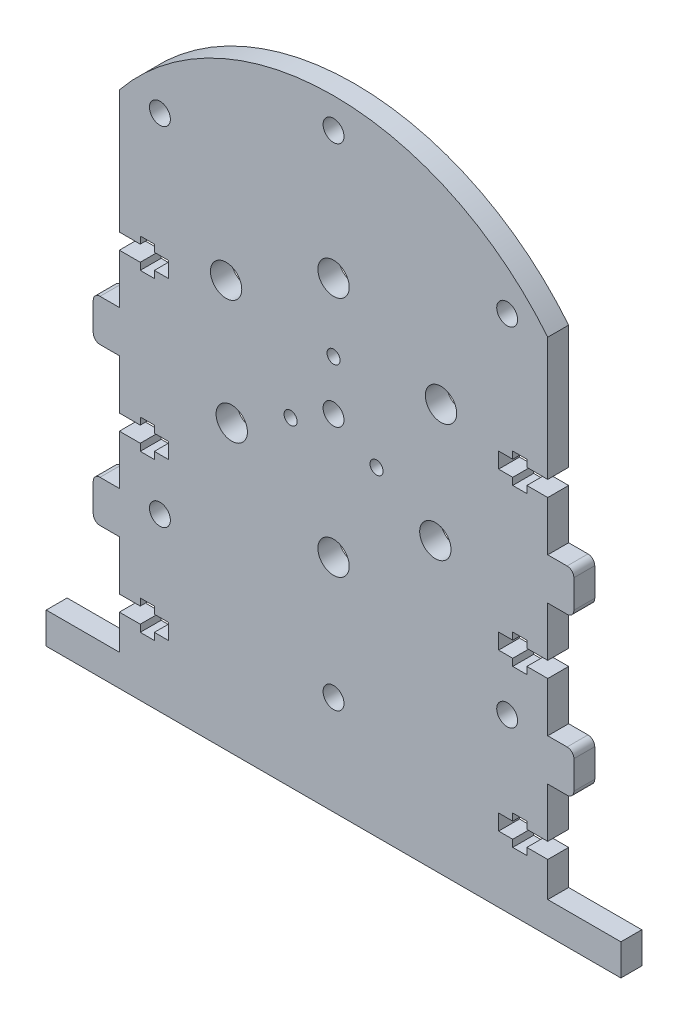
from build123d import *

# Parameters (mm, degrees)
SKETCH_1_R      = 3
SKETCH_1_R_2    = 2
SKETCH_1_R_3    = 1.25
EXTRUDE_2_DEPTH = 4
SKETCH_4_W      = 110
SKETCH_4_H      = 6
EXTRUDE_3_DEPTH = 4
FILLET_1_R      = 1.3


with BuildPart() as part:
    # 草图1 → 凸台-拉伸2 (new body)
    with BuildSketch(Plane.XY):
        with BuildLine():
            Line((26.037512023, -61.503506411), (-55.962487977, -61.503506411))
            Line((-55.962487977, -61.503506411), (-55.962487977, -54.853506411))
            Line((-55.962487977, -54.853506411), (-51.962487977, -54.853506411))
            Line((-51.962487977, -54.853506411), (-51.962487977, -56.203506411))
            Line((-51.962487977, -56.203506411), (-49.262487977, -56.203506411))
            Line((-49.262487977, -56.203506411), (-49.262487977, -54.853506411))
            Line((-49.262487977, -54.853506411), (-46.562487977, -54.853506411))
            Line((-46.562487977, -54.853506411), (-46.562487977, -51.853506411))
            Line((-46.562487977, -51.853506411), (-49.262487977, -51.853506411))
            Line((-49.262487977, -51.853506411), (-49.262487977, -50.503506411))
            Line((-49.262487977, -50.503506411), (-51.962487977, -50.503506411))
            Line((-51.962487977, -50.503506411), (-51.962487977, -51.853506411))
            Line((-51.962487977, -51.853506411), (-55.962487977, -51.853506411))
            Line((-55.962487977, -51.853506411), (-55.962487977, -42.353506411))
            Line((-55.962487977, -42.353506411), (-60.962487977, -42.353506411))
            Line((-60.962487977, -42.353506411), (-60.962487977, -34.353506411))
            Line((-60.962487977, -34.353506411), (-55.962487977, -34.353506411))
            Line((-55.962487977, -34.353506411), (-55.962487977, -24.853506411))
            Line((-55.962487977, -24.853506411), (-51.962487977, -24.853506411))
            Line((-51.962487977, -24.853506411), (-51.962487977, -26.203506411))
            Line((-51.962487977, -26.203506411), (-49.262487977, -26.203506411))
            Line((-49.262487977, -26.203506411), (-49.262487977, -24.853506411))
            Line((-49.262487977, -24.853506411), (-46.562487977, -24.853506411))
            Line((-46.562487977, -24.853506411), (-46.562487977, -21.853506411))
            Line((-46.562487977, -21.853506411), (-49.262487977, -21.853506411))
            Line((-49.262487977, -21.853506411), (-49.262487977, -20.503506411))
            Line((-49.262487977, -20.503506411), (-51.962487977, -20.503506411))
            Line((-51.962487977, -20.503506411), (-51.962487977, -21.853506411))
            Line((-51.962487977, -21.853506411), (-55.962487977, -21.853506411))
            Line((-55.962487977, -21.853506411), (-55.962487977, -12.353506411))
            Line((-55.962487977, -12.353506411), (-60.962487977, -12.353506411))
            Line((-60.962487977, -12.353506411), (-60.962487977, -4.353506411))
            Line((-60.962487977, -4.353506411), (-55.962487977, -4.353506411))
            Line((-55.962487977, -4.353506411), (-55.962487977, 5.146493589))
            Line((-55.962487977, 5.146493589), (-51.962487977, 5.146493589))
            Line((-51.962487977, 5.146493589), (-51.962487977, 3.796493589))
            Line((-51.962487977, 3.796493589), (-49.262487977, 3.796493589))
            Line((-49.262487977, 3.796493589), (-49.262487977, 5.146493589))
            Line((-49.262487977, 5.146493589), (-46.562487977, 5.146493589))
            Line((-46.562487977, 5.146493589), (-46.562487977, 8.146493589))
            Line((-46.562487977, 8.146493589), (-49.262487977, 8.146493589))
            Line((-49.262487977, 8.146493589), (-49.262487977, 9.496493589))
            Line((-49.262487977, 9.496493589), (-51.962487977, 9.496493589))
            Line((-51.962487977, 9.496493589), (-51.962487977, 8.146493589))
            Line((-51.962487977, 8.146493589), (-55.962487977, 8.146493589))
            Line((-55.962487977, 8.146493589), (-55.962487977, 23.496493589))
            Line((-55.962487977, 23.496493589), (-55.962487977, 31.722989041))
            ThreePointArc((-55.962487977, 31.722989041), (-14.962487977, 51.269592797), (26.037512023, 31.722989041))
            Line((26.037512023, 31.722989041), (26.037512023, 23.496493589))
            Line((26.037512023, 23.496493589), (26.037512023, 8.146493589))
            Line((26.037512023, 8.146493589), (22.037512023, 8.146493589))
            Line((22.037512023, 8.146493589), (22.037512023, 9.496493589))
            Line((22.037512023, 9.496493589), (19.337512023, 9.496493589))
            Line((19.337512023, 9.496493589), (19.337512023, 8.146493589))
            Line((19.337512023, 8.146493589), (16.637512023, 8.146493589))
            Line((16.637512023, 8.146493589), (16.637512023, 5.146493589))
            Line((16.637512023, 5.146493589), (19.337512023, 5.146493589))
            Line((19.337512023, 5.146493589), (19.337512023, 3.796493589))
            Line((19.337512023, 3.796493589), (22.037512023, 3.796493589))
            Line((22.037512023, 3.796493589), (22.037512023, 5.146493589))
            Line((22.037512023, 5.146493589), (26.037512023, 5.146493589))
            Line((26.037512023, 5.146493589), (26.037512023, -4.353506411))
            Line((26.037512023, -4.353506411), (31.037512023, -4.353506411))
            Line((31.037512023, -4.353506411), (31.037512023, -12.353506411))
            Line((31.037512023, -12.353506411), (26.037512023, -12.353506411))
            Line((26.037512023, -12.353506411), (26.037512023, -21.853506411))
            Line((26.037512023, -21.853506411), (22.037512023, -21.853506411))
            Line((22.037512023, -21.853506411), (22.037512023, -20.503506411))
            Line((22.037512023, -20.503506411), (19.337512023, -20.503506411))
            Line((19.337512023, -20.503506411), (19.337512023, -21.853506411))
            Line((19.337512023, -21.853506411), (16.637512023, -21.853506411))
            Line((16.637512023, -21.853506411), (16.637512023, -24.853506411))
            Line((16.637512023, -24.853506411), (19.337512023, -24.853506411))
            Line((19.337512023, -24.853506411), (19.337512023, -26.203506411))
            Line((19.337512023, -26.203506411), (22.037512023, -26.203506411))
            Line((22.037512023, -26.203506411), (22.037512023, -24.853506411))
            Line((22.037512023, -24.853506411), (26.037512023, -24.853506411))
            Line((26.037512023, -24.853506411), (26.037512023, -34.353506411))
            Line((26.037512023, -34.353506411), (31.037512023, -34.353506411))
            Line((31.037512023, -34.353506411), (31.037512023, -42.353506411))
            Line((31.037512023, -42.353506411), (26.037512023, -42.353506411))
            Line((26.037512023, -42.353506411), (26.037512023, -51.853506411))
            Line((26.037512023, -51.853506411), (22.037512023, -51.853506411))
            Line((22.037512023, -51.853506411), (22.037512023, -50.503506411))
            Line((22.037512023, -50.503506411), (19.337512023, -50.503506411))
            Line((19.337512023, -50.503506411), (19.337512023, -51.853506411))
            Line((19.337512023, -51.853506411), (16.637512023, -51.853506411))
            Line((16.637512023, -51.853506411), (16.637512023, -54.853506411))
            Line((16.637512023, -54.853506411), (19.337512023, -54.853506411))
            Line((19.337512023, -54.853506411), (19.337512023, -56.203506411))
            Line((19.337512023, -56.203506411), (22.037512023, -56.203506411))
            Line((22.037512023, -56.203506411), (22.037512023, -54.853506411))
            Line((22.037512023, -54.853506411), (26.037512023, -54.853506411))
            Line((26.037512023, -54.853506411), (26.037512023, -61.503506411))
        make_face()
        with Locations((-14.962487977, -25.253506411)):
            Circle(SKETCH_1_R, mode=Mode.SUBTRACT)
        with Locations((4.523083608, -12.753506411)):
            Circle(SKETCH_1_R, mode=Mode.SUBTRACT)
        with Locations((-14.962487977, -1.503506411)):
            Circle(SKETCH_1_R_2, mode=Mode.SUBTRACT)
        with Locations((-35.530591317, 10.371493589)):
            Circle(SKETCH_1_R, mode=Mode.SUBTRACT)
        with Locations((-34.448059562, -12.753506411)):
            Circle(SKETCH_1_R, mode=Mode.SUBTRACT)
        with Locations((5.605615363, 10.371493589)):
            Circle(SKETCH_1_R, mode=Mode.SUBTRACT)
        with Locations((-14.962487977, 20.996493589)):
            Circle(SKETCH_1_R, mode=Mode.SUBTRACT)
        with Locations((18.271530739, -34.737525127)):
            Circle(SKETCH_1_R_2, mode=Mode.SUBTRACT)
        with Locations((-14.962487977, -48.503506411)):
            Circle(SKETCH_1_R_2, mode=Mode.SUBTRACT)
        with Locations((-48.196506692, -34.737525127)):
            Circle(SKETCH_1_R_2, mode=Mode.SUBTRACT)
        with Locations((-48.196506692, 31.730512305)):
            Circle(SKETCH_1_R_2, mode=Mode.SUBTRACT)
        with Locations((-14.962487977, 45.496493589)):
            Circle(SKETCH_1_R_2, mode=Mode.SUBTRACT)
        with Locations((18.271530739, 31.730512305)):
            Circle(SKETCH_1_R_2, mode=Mode.SUBTRACT)
        with Locations((-14.962487977, 7.996493589)):
            Circle(SKETCH_1_R_3, mode=Mode.SUBTRACT)
        with Locations((-6.735246641, -6.253506411)):
            Circle(SKETCH_1_R_3, mode=Mode.SUBTRACT)
        with Locations((-23.189729313, -6.253506411)):
            Circle(SKETCH_1_R_3, mode=Mode.SUBTRACT)
    extrude(amount=EXTRUDE_2_DEPTH)

    # 草图4 → 凸台-拉伸3 (add)
    with BuildSketch(Plane.XY.offset(4)):
        with Locations((-14.962487977, -64.503506411)):
            Rectangle(SKETCH_4_W, SKETCH_4_H)
    extrude(amount=-EXTRUDE_3_DEPTH)

    # 圆角1
    fillet_1_edges = [part.edges().sort_by_distance(p)[0] for p in [
        (-60.962487977, -42.353506411, 2),
        (-60.962487977, -34.353506411, 2),
        (-60.962487977, -12.353506411, 2),
        (-60.962487977, -4.353506411, 2),
        (31.037512023, -4.353506411, 2),
        (31.037512023, -12.353506411, 2),
        (31.037512023, -34.353506411, 2),
        (31.037512023, -42.353506411, 2),
    ]]
    fillet(fillet_1_edges, radius=FILLET_1_R)


solid = part.part
